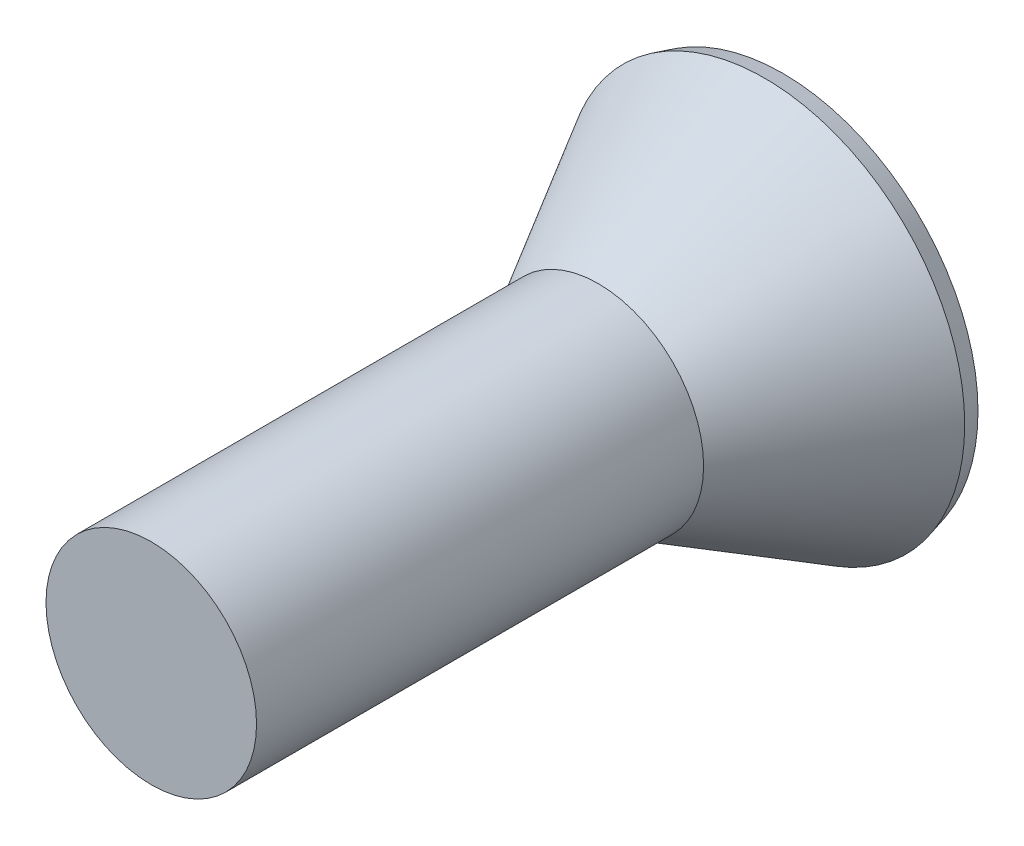
from build123d import *

# Parameters (mm, degrees)
CUT_EXTRUDE_1_DEPTH = 1.5
CHAMFER_1_SIZE      = 0.2
CHAMFER_1_SIZE2     = 0.146618763


with BuildPart() as part:
    # 草图1 → 旋转5 (revolve)
    with BuildSketch(Plane(origin=(0, 0, 0), x_dir=(1, 0, 0), z_dir=(0, 1, 0))):
        Polygon((-2.008479615, -0.003832891), (-0.008479615, -0.003832891), (-0.008479615, -6.003832891), (-1.008479615, -6.003832891), (-1.008479615, -1.757110008), align=None)
    revolve(axis=Axis((-0.008479615, 0, 0.003832891), (0, 0, 1)))

    # 草图2 → 切除-拉伸1 (cut)
    with BuildSketch(Plane.XY.offset(0.003832891)):
        Polygon((0.857545789, 0), (0.424533087, 0.75), (-0.441492317, 0.75), (-0.874505018, 0), (-0.441492317, -0.75), (0.424533087, -0.75), align=None)
    extrude(amount=CUT_EXTRUDE_1_DEPTH, mode=Mode.SUBTRACT)

    # 倒角1
    chamfer_1_edges = [part.edges().sort_by_distance(p)[0] for p in [
        (1.991520385, 0, 0.003832891),
    ]]
    chamfer_1_side = [part.faces().sort_by_distance(p)[0] for p in [
        (1.491520385, 0, 0.880471449),
    ]]
    chamfer(chamfer_1_edges, length=CHAMFER_1_SIZE, length2=CHAMFER_1_SIZE2, reference=chamfer_1_side[0])


solid = part.part
